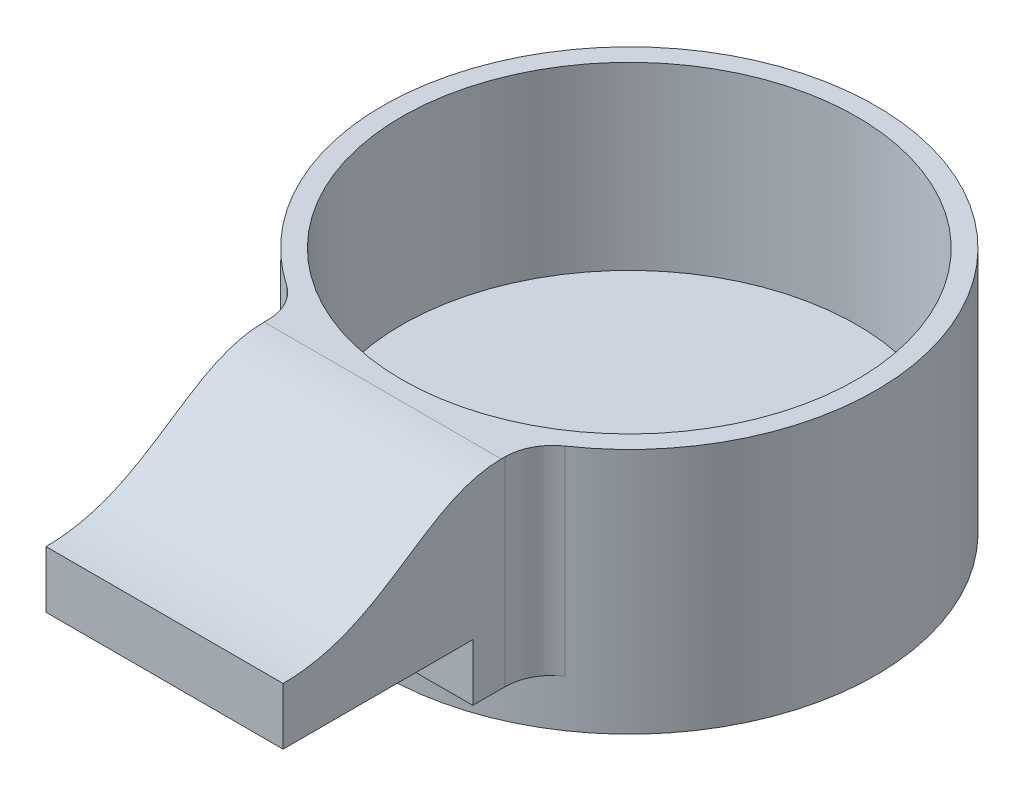
from build123d import *

# Parameters (mm, degrees)
SKETCH_1_R           = 26
EXTRUDE_1_DEPTH      = 2
SKETCH_2_R           = 26
SKETCH_2_R_2         = 24
EXTRUDE_2_DEPTH      = 19
EXTRUDE_3_REACH      = 84.11
EXTRUDE_3_END_RADIUS = 26
SKETCH_4_W           = 25
SKETCH_4_H           = 12
SKETCH_5_W           = 25
SKETCH_5_H           = 20
CUT_EXTRUDE_1_DEPTH  = 6
EXTRUDE_5_REACH      = 67.759
CUT_EXTRUDE_START    = -19
SKETCH_7_R           = 24
CUT_EXTRUDE_2_DEPTH  = 19
EXTRUDE_START        = 5
SKETCH_8_R           = 24
EXTRUDE_6_DEPTH      = 5
FILLET_1_R           = 5


with BuildPart() as part:
    # Эскиз1 → Бобышка-Вытянуть1 (new body)
    with BuildSketch(Plane(origin=(0, 0, 0), x_dir=(1, 0, 0), z_dir=(0, 1, 0))):
        with Locations(Location((0, 0, 0), (0, 0, 270))):
            Circle(SKETCH_1_R)
    extrude(amount=EXTRUDE_1_DEPTH)

    # Эскиз2 → Бобышка-Вытянуть2 (add)
    with BuildSketch(Plane(origin=(0, 2, 0), x_dir=(1, 0, 0), z_dir=(0, 1, 0))):
        with Locations(Location((0, 0, 0), (0, 0, 270))):
            Circle(SKETCH_2_R)
        with Locations(Location((0, 0, 0), (0, 0, 270))):
            Circle(SKETCH_2_R_2, mode=Mode.SUBTRACT)
    extrude(amount=EXTRUDE_2_DEPTH)

    # Бобышка-Вытянуть3: up to this cylinder (the profile starts outside it)
    extrude_3_end = Plane(origin=(0, 6, 0), z_dir=(0, -1, 0)) * Cylinder(EXTRUDE_3_END_RADIUS, 221.22, mode=Mode.PRIVATE)
    # Эскиз4 → Бобышка-Вытянуть3 (add, up to the surface)
    with BuildSketch(Plane.XY.offset(49), mode=Mode.PRIVATE) as extrude_3_sk1:
        with Locations((0, 6)):
            Rectangle(SKETCH_4_W, SKETCH_4_H)
    extrude_3_tool1 = extrude(extrude_3_sk1.sketch, amount=-EXTRUDE_3_REACH, mode=Mode.PRIVATE) - extrude_3_end
    add(extrude_3_tool1.solids().sort_by_distance((0, 6, 49))[0])

    # Эскиз5 → Вырез-Вытянуть1 (cut)
    with BuildSketch(Plane.XZ):
        with Locations((0, 39)):
            Rectangle(SKETCH_5_W, SKETCH_5_H)
    extrude(amount=-CUT_EXTRUDE_1_DEPTH, mode=Mode.SUBTRACT)

    # Бобышка-Вытянуть5: up to this face of the body (flat: up to its plane)
    extrude_5_end = Plane(part.part.faces().sort_by_distance((-12.5, 7.851626254, 33.985056872))[0])
    # Эскиз6 → Бобышка-Вытянуть5 (add, up to the picked face)
    with BuildSketch(Plane(origin=(12.5, 0, 0), x_dir=(0, 0, -1), z_dir=(1, 0, 0)), mode=Mode.PRIVATE) as extrude_5_sk1:
        with BuildLine():
            Line((-26, 21), (-22.79802623, 21))
            Line((-22.79802623, 21), (-22.79802623, 12))
            Line((-22.79802623, 12), (-49, 12))
            add(Edge.make_bspline(
                [(-49, 12), (-38.341292939, 12), (-34.129850558, 21), (-26, 21)],
                knots=[0, 0, 0, 0, 1, 1, 1, 1], degree=3))
        make_face()
    extrude_5_tool1 = split(extrude(extrude_5_sk1.sketch, amount=-EXTRUDE_5_REACH, mode=Mode.PRIVATE), bisect_by=extrude_5_end, keep=Keep.BOTH, mode=Mode.PRIVATE)
    add(extrude_5_tool1.solids().sort_by(Axis((12.5, 15.609347, 30.602096), (-1, 0, 0)))[0])

    # Эскиз7 → Вырез-Вытянуть2 (cut)
    with BuildSketch(Plane(origin=(0, 21, 0), x_dir=(1, 0, 0), z_dir=(0, 1, 0)).offset(CUT_EXTRUDE_START)):
        with Locations(Location((0, 0, 0), (0, 0, 270))):
            Circle(SKETCH_7_R)
    extrude(amount=CUT_EXTRUDE_2_DEPTH, mode=Mode.SUBTRACT)

    # Эскиз8 → Бобышка-Вытянуть6 (add)
    with BuildSketch(Plane.XZ.offset(EXTRUDE_START)):
        with BuildLine():
            ThreePointArc((-12.5, 22.79802623), (0, -26), (12.5, 22.79802623))
            ThreePointArc((12.5, 22.79802623), (0, 26), (-12.5, 22.79802623))
        make_face()
        with Locations(Location((0, 0, 0), (0, 0, 90))):
            Circle(SKETCH_8_R, mode=Mode.SUBTRACT)
    extrude(amount=-EXTRUDE_6_DEPTH)

    # Скругление1
    fillet_1_edges = [part.edges().sort_by_distance(p)[0] for p in [
        (12.5, 10.5, 22.79802623),
        (-12.5, 10.5, 22.79802623),
    ]]
    fillet(fillet_1_edges, radius=FILLET_1_R)


solid = part.part
